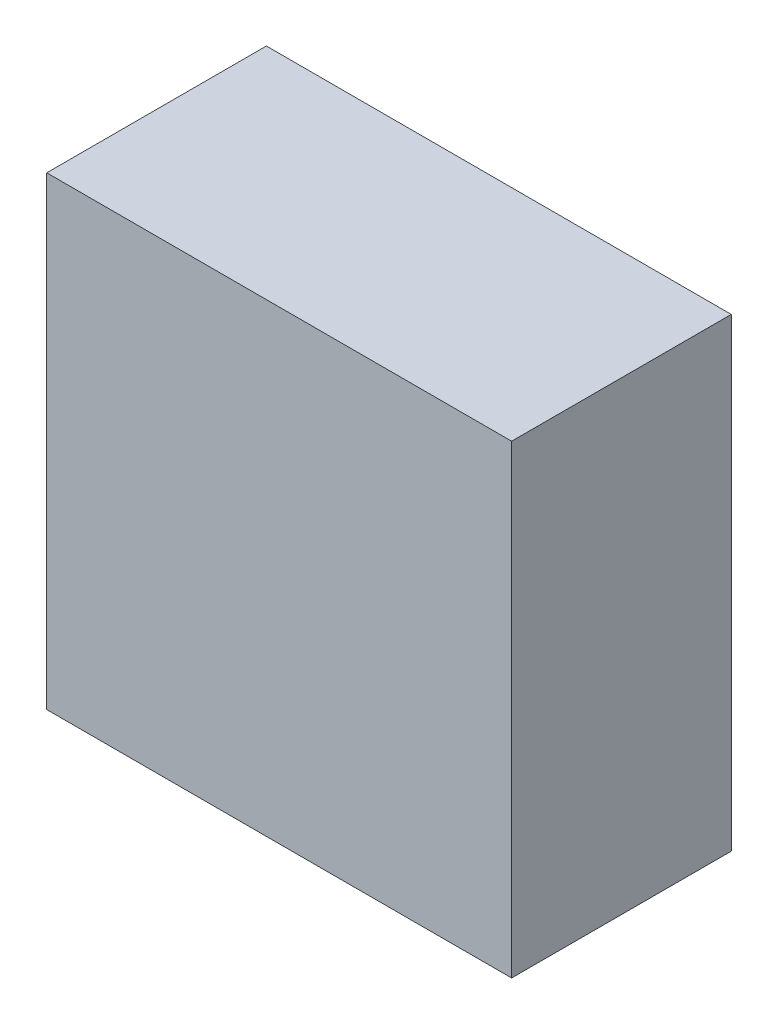
from build123d import *

# Parameters (mm, degrees)
SKETCH1_W                       = 12.7
SKETCH1_H                       = 12.7
BOSS_EXTRUDE1_DEPTH             = 6
TAP_DRILL_FOR_M3X0_5_TAP3_D     = 2.5
TAP_DRILL_FOR_M3X0_5_TAP3_DEPTH = 4
TAP_DRILL_FOR_M3X0_5_TAP3_TIP   = 0.751075774


with BuildPart() as part:
    # Sketch1 → Boss-Extrude1 (new body)
    with BuildSketch(Plane.XY):
        Rectangle(SKETCH1_W, SKETCH1_H)
    extrude(amount=BOSS_EXTRUDE1_DEPTH)

    # Tap Drill for M3x0.5 Tap3
    with Locations(Plane(origin=(0, 0, 0), x_dir=(1, 0, 0), z_dir=(0, 0, -1))):
        with Locations((0, 0)):
            Hole(TAP_DRILL_FOR_M3X0_5_TAP3_D / 2, depth=TAP_DRILL_FOR_M3X0_5_TAP3_DEPTH)
            with Locations((0, 0, -(TAP_DRILL_FOR_M3X0_5_TAP3_DEPTH + TAP_DRILL_FOR_M3X0_5_TAP3_TIP / 2))):  # 118° drill point
                Cone(0, TAP_DRILL_FOR_M3X0_5_TAP3_D / 2, TAP_DRILL_FOR_M3X0_5_TAP3_TIP, mode=Mode.SUBTRACT)


solid = part.part
